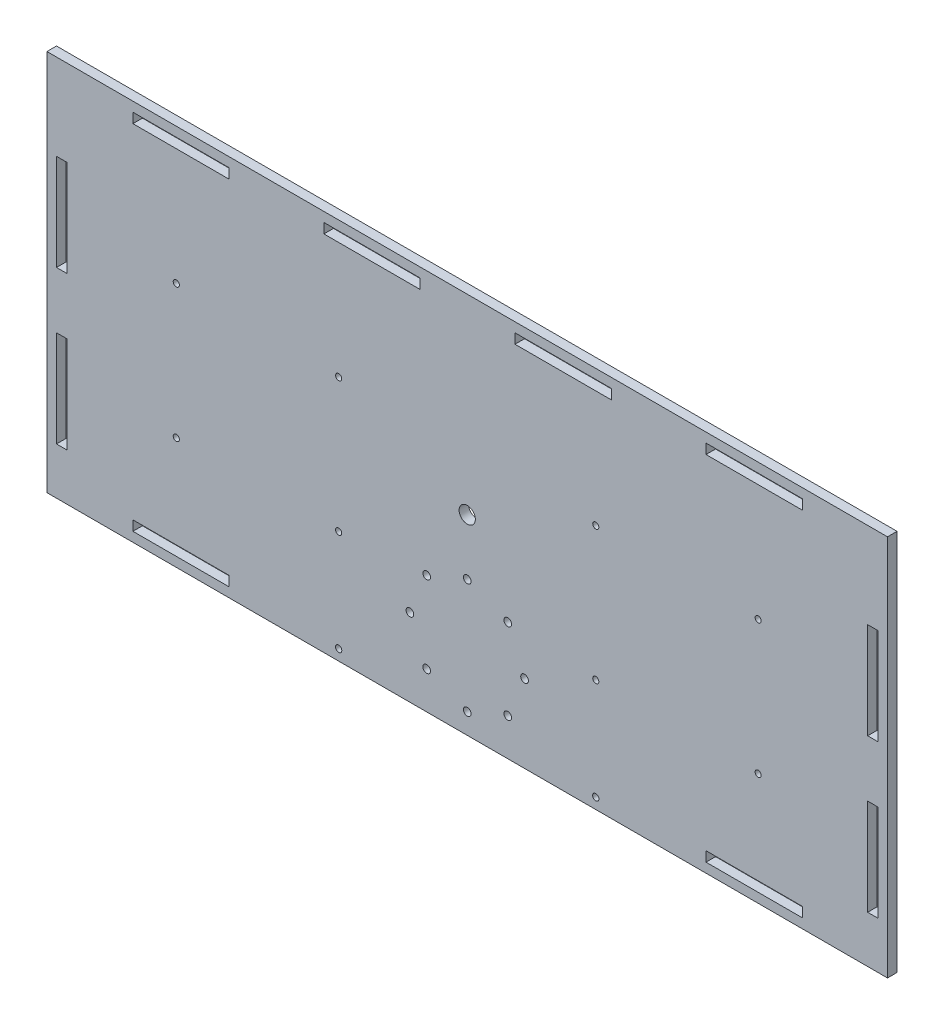
from build123d import *

# Parameters (mm, degrees)
ESQUISSE1_R        = 1.65
ESQUISSE1_R_2      = 1.603139346
ESQUISSE1_R_3      = 1.605
ESQUISSE1_R_4      = 4.25
ESQUISSE1_R_5      = 2
ESQUISSE1_W        = 50.4
ESQUISSE1_H        = 5.2
ESQUISSE1_W_2      = 5.4
ESQUISSE1_H_2      = 50.4
BOSS_EXTRU_1_DEPTH = 5


with BuildPart() as part:
    # Esquisse1 → Boss.-Extru.1 (new body)
    with BuildSketch(Plane.XY):
        Polygon((-220, 100), (-0.145812859, 100), (9.854187141, 100), (220, 100), (220, -100), (-220, -100), align=None)
        with Locations((-67.3, -94.376990981)):
            Circle(ESQUISSE1_R, mode=Mode.SUBTRACT)
        with Locations(Location((67.3, -94.376990981, 0), (0, 0, 180))):
            Circle(ESQUISSE1_R, mode=Mode.SUBTRACT)
        with Locations((152.3, -41.249056917)):
            Circle(ESQUISSE1_R_2, mode=Mode.SUBTRACT)
        with Locations((152.3, 28.750943083)):
            Circle(ESQUISSE1_R_3, mode=Mode.SUBTRACT)
        with Locations((67.3, 28.750943083)):
            Circle(ESQUISSE1_R_3, mode=Mode.SUBTRACT)
        with Locations((67.3, -41.249056917)):
            Circle(ESQUISSE1_R_3, mode=Mode.SUBTRACT)
        with Locations((-67.3, 28.750943083)):
            Circle(ESQUISSE1_R_3, mode=Mode.SUBTRACT)
        with Locations((-67.3, -41.249056917)):
            Circle(ESQUISSE1_R_3, mode=Mode.SUBTRACT)
        with Locations((-152.3, 28.750943083)):
            Circle(ESQUISSE1_R_3, mode=Mode.SUBTRACT)
        with Locations((-152.3, -41.249056917)):
            Circle(ESQUISSE1_R_3, mode=Mode.SUBTRACT)
        Circle(ESQUISSE1_R_4, mode=Mode.SUBTRACT)
        with Locations((0, -29.269007759)):
            Circle(ESQUISSE1_R_5, mode=Mode.SUBTRACT)
        with Locations((21.213203436, -38.055804324)):
            Circle(ESQUISSE1_R_5, mode=Mode.SUBTRACT)
        with Locations((30, -59.269007759)):
            Circle(ESQUISSE1_R_5, mode=Mode.SUBTRACT)
        with Locations((21.213203436, -80.482211195)):
            Circle(ESQUISSE1_R_5, mode=Mode.SUBTRACT)
        with Locations((0, -89.269007759)):
            Circle(ESQUISSE1_R_5, mode=Mode.SUBTRACT)
        with Locations((-21.213203436, -80.482211195)):
            Circle(ESQUISSE1_R_5, mode=Mode.SUBTRACT)
        with Locations((-30, -59.269007759)):
            Circle(ESQUISSE1_R_5, mode=Mode.SUBTRACT)
        with Locations((-21.213203436, -38.055804324)):
            Circle(ESQUISSE1_R_5, mode=Mode.SUBTRACT)
        with Locations((-49.8, 92.4)):
            Rectangle(ESQUISSE1_W, ESQUISSE1_H, mode=Mode.SUBTRACT)
        with Locations((-149.8, 92.4)):
            Rectangle(ESQUISSE1_W, ESQUISSE1_H, mode=Mode.SUBTRACT)
        with Locations((50.2, 92.4)):
            Rectangle(ESQUISSE1_W, ESQUISSE1_H, mode=Mode.SUBTRACT)
        with Locations((150.2, 92.4)):
            Rectangle(ESQUISSE1_W, ESQUISSE1_H, mode=Mode.SUBTRACT)
        with Locations((-212.3, -50.2)):
            Rectangle(ESQUISSE1_W_2, ESQUISSE1_H_2, mode=Mode.SUBTRACT)
        with Locations((-212.3, 29.8)):
            Rectangle(ESQUISSE1_W_2, ESQUISSE1_H_2, mode=Mode.SUBTRACT)
        with Locations((212.3, -50.2)):
            Rectangle(ESQUISSE1_W_2, ESQUISSE1_H_2, mode=Mode.SUBTRACT)
        with Locations((212.3, 29.8)):
            Rectangle(ESQUISSE1_W_2, ESQUISSE1_H_2, mode=Mode.SUBTRACT)
        with Locations((150.2, -92.4)):
            Rectangle(ESQUISSE1_W, ESQUISSE1_H, mode=Mode.SUBTRACT)
        with Locations((-149.8, -92.4)):
            Rectangle(ESQUISSE1_W, ESQUISSE1_H, mode=Mode.SUBTRACT)
    extrude(amount=BOSS_EXTRU_1_DEPTH)


solid = part.part
